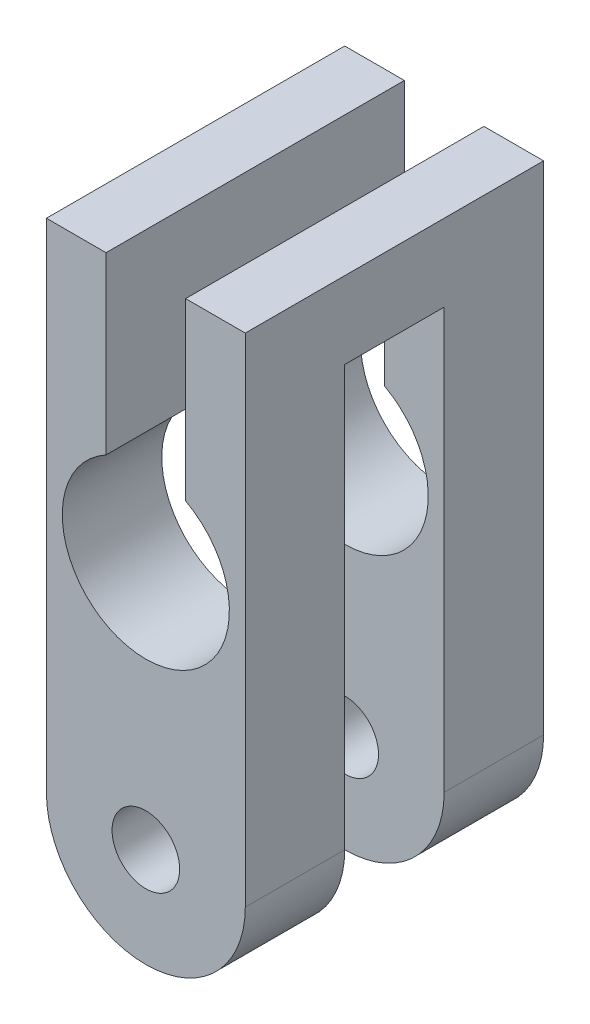
from build123d import *

# Parameters (mm, degrees)
BOSS_EXTRUDE1_DEPTH = 5
SKETCH2_R           = 1.7
CUT_EXTRUDE1_DEPTH  = 28.386127875
SKETCH5_W           = 3
SKETCH5_H           = 4
SKETCH5_H_2         = 3.869300193
BOSS_EXTRUDE2_DEPTH = 10
SKETCH7_R           = 1.7
CUT_EXTRUDE2_DEPTH  = 31.822070015


with BuildPart() as part:
    # Sketch1 → Boss-Extrude1 (new body)
    with BuildSketch(Plane(origin=(0, 0, 0), x_dir=(0, 1, 0), z_dir=(0, 0, 1))):
        with BuildLine():
            Line((0, 0), (25, 0))
            Line((25, 0), (25, 3))
            Line((25, 3), (16.193237063, 3))
            ThreePointArc((16.193237063, 3), (8.3, 5), (16.193237063, 7))
            Line((16.193237063, 7), (25, 7))
            Line((25, 7), (25, 10))
            Line((25, 10), (0, 10))
            ThreePointArc((0, 10), (-5, 5), (0, 0))
        make_face()
    boss_extrude1 = extrude(amount=BOSS_EXTRUDE1_DEPTH)

    # Sketch2 → Cut-Extrude1 (cut, through all)
    with BuildSketch(Plane.XY.offset(5)):
        with Locations((-5, 0)):
            Circle(SKETCH2_R)
    extrude(amount=-CUT_EXTRUDE1_DEPTH, mode=Mode.SUBTRACT)

    # Sketch5 → Boss-Extrude2 (add)
    with BuildSketch(Plane.XY.offset(15)):
        with Locations((-8.5, 23)):
            Rectangle(SKETCH5_W, SKETCH5_H)
        with Locations((-1.5, 23.065349903)):
            Rectangle(SKETCH5_W, SKETCH5_H_2)
    extrude(amount=-BOSS_EXTRUDE2_DEPTH)

    # Mirror2: Boss-Extrude1 across plane
    add(boss_extrude1.mirror(Plane.XY.offset(7.5)))

    # Sketch7 → Cut-Extrude2 (cut, through all)
    with BuildSketch(Plane.XY.offset(15)):
        with Locations((-5, 0)):
            Circle(SKETCH7_R)
    extrude(amount=-CUT_EXTRUDE2_DEPTH, mode=Mode.SUBTRACT)


solid = part.part
